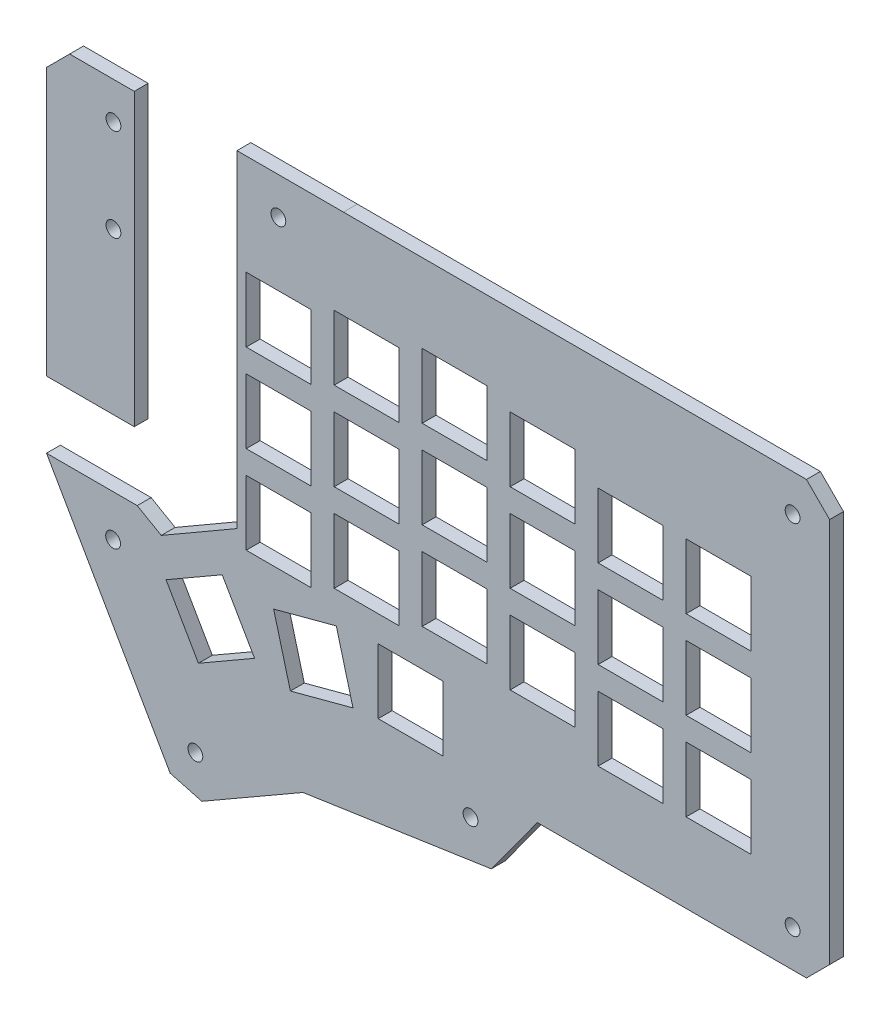
from build123d import *

# Parameters (mm, degrees)
SWITCHPLATE_R           = 1.6
SWITCHPLATE_W           = 14.000982373
SWITCHPLATE_H           = 14.000982374
SWITCHPLATE_H_2         = 14.000982373
SWITCHPLATE_W_2         = 14.000982374
BOSS_EXTRU_2_DEPTH      = 3
ESQUISSE1_W             = 20.456160795
ESQUISSE1_H             = 14.420470361
ENL_V_MAT_EXTRU_1_DEPTH = 10


with BuildPart() as part:
    # Switchplate → Boss.-Extru.2 (new body)
    with BuildSketch(Plane.XY):
        Polygon((-160.478985875, -70.841138967), (-133.761270027, -117.344044002), (-126.936961278, -119.18521524), (-105.07834936, -106.603969177), (-64.409664562, -100.558603138), (-54.463628843, -86.933633781), (3.660893039, -86.933633781), (8.660893039, -81.933633781), (8.660893039, 1.315012353), (3.660893047, 6.315290442), (-96.344426674, 6.320852512), (-103.340940531, 6.320852512), (-119.346315028, 6.320852512), (-119.346315028, 1.570515597), (-119.346630506, -64.372807463), (-135.694988334, -73.831500172), (-141.52282508, -70.47035259), (-141.52282508, 1.570515597), (-141.52282508, 6.320852512), (-155.478985875, 6.320852512), (-160.478985875, 1.320852512), (-160.478985875, -3.429484403), align=None)
        with Locations((0.660893039, -1.684542717)):
            Circle(SWITCHPLATE_R, mode=Mode.SUBTRACT)
        with Locations((-110.397084988, -1.678365923)):
            Circle(SWITCHPLATE_R, mode=Mode.SUBTRACT)
        with Locations((0.660893039, -78.933633781)):
            Circle(SWITCHPLATE_R, mode=Mode.SUBTRACT)
        with Locations((-68.897334865, -93.137788223)):
            Circle(SWITCHPLATE_R, mode=Mode.SUBTRACT)
        with Locations((-128.322250168, -110.752044388)):
            Circle(SWITCHPLATE_R, mode=Mode.SUBTRACT)
        with Locations((-146.0923789, -79.822656053)):
            Circle(SWITCHPLATE_R, mode=Mode.SUBTRACT)
        with Locations((-146.02282508, -1.677868186)):
            Circle(SWITCHPLATE_R, mode=Mode.SUBTRACT)
        with Locations((-146.02282508, -21.682390047)):
            Circle(SWITCHPLATE_R, mode=Mode.SUBTRACT)
        with Locations((-110.341431718, -22.42033468)):
            Rectangle(SWITCHPLATE_W, SWITCHPLATE_H, mode=Mode.SUBTRACT)
        with Locations((-91.340084057, -20.045166224)):
            Rectangle(SWITCHPLATE_W, SWITCHPLATE_H_2, mode=Mode.SUBTRACT)
        with Locations((-72.338736396, -17.669997767)):
            Rectangle(SWITCHPLATE_W_2, SWITCHPLATE_H, mode=Mode.SUBTRACT)
        with Locations((-53.337388735, -20.045166225)):
            Rectangle(SWITCHPLATE_W_2, SWITCHPLATE_H, mode=Mode.SUBTRACT)
        with Locations((-34.336041075, -24.795503141)):
            Rectangle(SWITCHPLATE_W_2, SWITCHPLATE_H, mode=Mode.SUBTRACT)
        with Locations((-15.334185378, -24.795503142)):
            Rectangle(SWITCHPLATE_W_2, SWITCHPLATE_H, mode=Mode.SUBTRACT)
        with Locations((-110.341431718, -41.421682341)):
            Rectangle(SWITCHPLATE_W_2, SWITCHPLATE_H, mode=Mode.SUBTRACT)
        with Locations((-91.340084058, -39.046513884)):
            Rectangle(SWITCHPLATE_W, SWITCHPLATE_H, mode=Mode.SUBTRACT)
        with Locations((-72.338736397, -36.671345428)):
            Rectangle(SWITCHPLATE_W_2, SWITCHPLATE_H_2, mode=Mode.SUBTRACT)
        with Locations((-53.337388736, -39.046513886)):
            Rectangle(SWITCHPLATE_W_2, SWITCHPLATE_H, mode=Mode.SUBTRACT)
        with Locations((-34.336041076, -43.796850802)):
            Rectangle(SWITCHPLATE_W, SWITCHPLATE_H, mode=Mode.SUBTRACT)
        with Locations((-15.334185379, -43.796850803)):
            Rectangle(SWITCHPLATE_W_2, SWITCHPLATE_H, mode=Mode.SUBTRACT)
        with Locations((-15.33418538, -62.798198464)):
            Rectangle(SWITCHPLATE_W_2, SWITCHPLATE_H_2, mode=Mode.SUBTRACT)
        with Locations((-34.336041077, -62.798198463)):
            Rectangle(SWITCHPLATE_W, SWITCHPLATE_H, mode=Mode.SUBTRACT)
        with Locations((-53.337388737, -58.047861547)):
            Rectangle(SWITCHPLATE_W_2, SWITCHPLATE_H, mode=Mode.SUBTRACT)
        with Locations((-72.338736397, -55.672693088)):
            Rectangle(SWITCHPLATE_W, SWITCHPLATE_H, mode=Mode.SUBTRACT)
        with Locations((-91.340084058, -58.047861545)):
            Rectangle(SWITCHPLATE_W_2, SWITCHPLATE_H, mode=Mode.SUBTRACT)
        with Locations((-110.341431719, -60.423030002)):
            Rectangle(SWITCHPLATE_W_2, SWITCHPLATE_H, mode=Mode.SUBTRACT)
        with Locations((-81.839410229, -77.674253537)):
            Rectangle(SWITCHPLATE_W_2, SWITCHPLATE_H, mode=Mode.SUBTRACT)
        Polygon((-111.417520933, -75.466480675), (-97.889935794, -71.856501764), (-94.279956882, -85.384086902), (-107.807542021, -88.994065814), align=None, mode=Mode.SUBTRACT)
        Polygon((-134.658112592, -81.599723585), (-122.528132256, -74.607507592), (-115.535916264, -86.737487928), (-127.665896599, -93.729703921), align=None, mode=Mode.SUBTRACT)
    extrude(amount=BOSS_EXTRU_2_DEPTH)

    # Esquisse1 → Enlèv. mat.-Extru.1 (cut)
    with BuildSketch(Plane.XY.offset(3)):
        with Locations((-150.250905477, -63.630903787)):
            Rectangle(ESQUISSE1_W, ESQUISSE1_H)
    extrude(amount=-ENL_V_MAT_EXTRU_1_DEPTH, mode=Mode.SUBTRACT)


with BuildPart() as enl_v_mat_extru_1_piece_1:
    # of the separate pieces the step leaves, piece 1, a body of its own (enl_v_mat_extru_1_pieces)
    add(part.part.solids().sort_by_distance((-160.478985875, -70.841138967, 0))[0])


with BuildPart() as enl_v_mat_extru_1_piece_2:
    # of the separate pieces the step leaves, piece 2, a body of its own (enl_v_mat_extru_1_pieces)
    add(part.part.solids().sort_by_distance((-160.478985875, 1.320852512, 0))[0])


solid = Compound([enl_v_mat_extru_1_piece_1.part, enl_v_mat_extru_1_piece_2.part])
